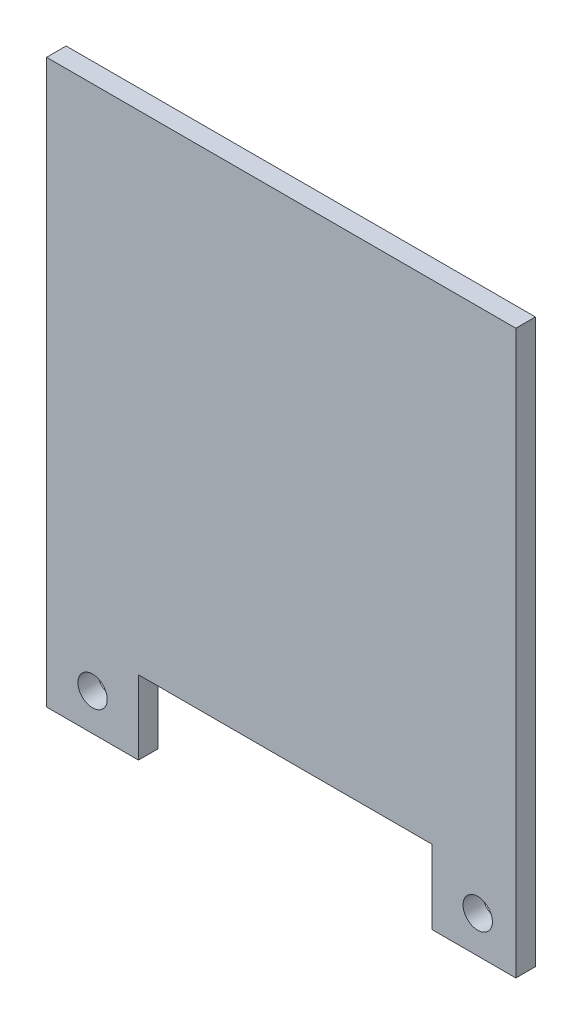
from build123d import *

# Parameters (mm, degrees)
BOSS_EXTRUDE1_DEPTH = 2.54
SKETCH2_R           = 1.905
CUT_EXTRUDE1_DEPTH  = 2.54


with BuildPart() as part:
    # Sketch1 → Boss-Extrude1 (new body)
    with BuildSketch(Plane.XY):
        Polygon((19.558, -36.5506), (30.48, -36.5506), (30.48, 36.5506), (-30.48, 36.5506), (-30.48, -36.5506), (-18.542, -36.5506), (-18.542, -26.9494), (19.558, -26.9494), align=None)
    extrude(amount=BOSS_EXTRUDE1_DEPTH)

    # Sketch2 → Cut-Extrude1 (cut)
    with BuildSketch(Plane.XY.offset(2.54)):
        with Locations((-24.511, -31.75)):
            Circle(SKETCH2_R)
        with Locations((25.527, -31.75)):
            Circle(SKETCH2_R)
    extrude(amount=-CUT_EXTRUDE1_DEPTH, mode=Mode.SUBTRACT)


solid = part.part
